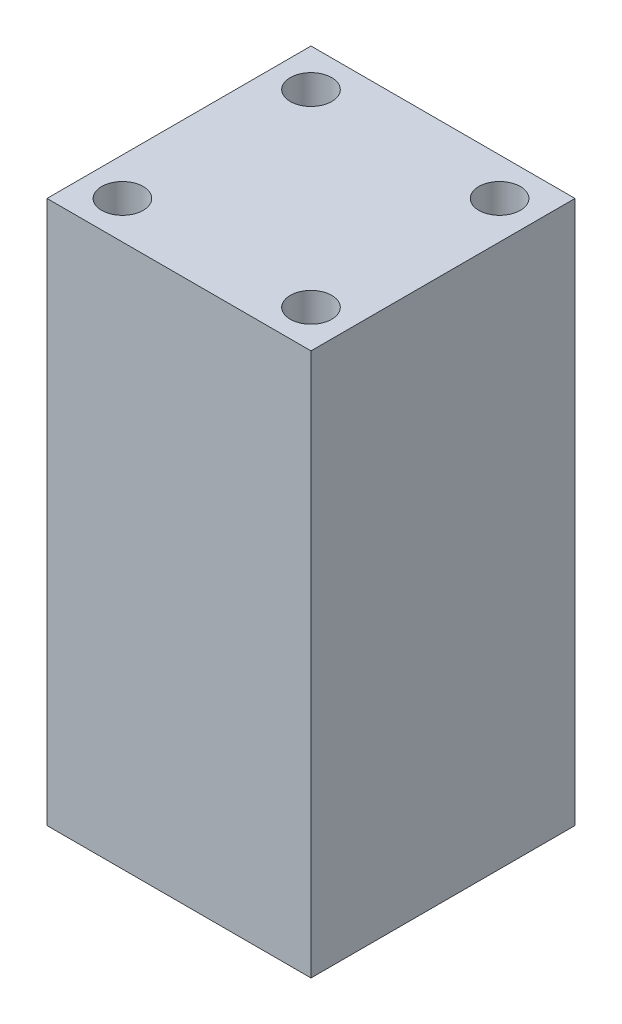
from build123d import *

# Parameters (mm, degrees)
SKETCH1_W           = 35
SKETCH1_H           = 72
BOSS_EXTRUDE1_DEPTH = 17.5


with BuildPart() as part:
    # Sketch1 → Boss-Extrude1 (new, symmetric)
    with BuildSketch(Plane.XY):
        Rectangle(SKETCH1_W, SKETCH1_H)
    extrude(amount=BOSS_EXTRUDE1_DEPTH, both=True)

    # Sketch3 → M5 Clearance Hole1 (revolve, cut)
    with BuildSketch(Plane(origin=(-12.5, 36, -12.5), x_dir=(0, 0, 1), z_dir=(1, 0, 0))):
        Polygon((0, 0), (0, 9.652366702), (2.75, 8), (2.75, 0), align=None)
    m5_clearance_hole1 = revolve(axis=Axis((-12.5, 42.35, -12.5), (0, -1, 0)), mode=Mode.SUBTRACT)

    # Mirror1: M5 Clearance Hole1 across plane
    add(m5_clearance_hole1.mirror(Plane(origin=(0, 0, 0), x_dir=(0, 0, 1), z_dir=(1, 0, 0))), mode=Mode.SUBTRACT)

    # Mirror2: M5 Clearance Hole1 across plane
    add(m5_clearance_hole1.mirror(Plane.XY), mode=Mode.SUBTRACT)

    # Mirror2 copy 1 sketch → Mirror2 copy 1 (revolve, cut)
    with BuildSketch(Plane(origin=(12.5, 36, 12.5), x_dir=(0, 0, -1), z_dir=(-1, 0, 0))):
        Polygon((0, 0), (0, 9.652366702), (2.75, 8), (2.75, 0), align=None)
    revolve(axis=Axis((12.5, 42.35, 12.5), (0, -1, 0)), mode=Mode.SUBTRACT)

    # Mirror3: M5 Clearance Hole1 across plane
    add(m5_clearance_hole1.mirror(Plane.ZX), mode=Mode.SUBTRACT)

    # Mirror3 copy 1 sketch → Mirror3 copy 1 (revolve, cut)
    with BuildSketch(Plane(origin=(12.5, -36, -12.5), x_dir=(0, 0, 1), z_dir=(-1, 0, 0))):
        Polygon((0, 0), (0, 9.652366702), (2.75, 8), (2.75, 0), align=None)
    revolve(axis=Axis((12.5, -42.35, -12.5), (0, 1, 0)), mode=Mode.SUBTRACT)

    # Mirror3 copy 2 sketch → Mirror3 copy 2 (revolve, cut)
    with BuildSketch(Plane(origin=(-12.5, -36, 12.5), x_dir=(0, 0, -1), z_dir=(1, 0, 0))):
        Polygon((0, 0), (0, 9.652366702), (2.75, 8), (2.75, 0), align=None)
    revolve(axis=Axis((-12.5, -42.35, 12.5), (0, 1, 0)), mode=Mode.SUBTRACT)

    # Mirror3 copy 3 sketch → Mirror3 copy 3 (revolve, cut)
    with BuildSketch(Plane(origin=(12.5, -36, 12.5), x_dir=(0, 0, -1), z_dir=(-1, 0, 0))):
        Polygon((0, 0), (0, -9.652366702), (2.75, -8), (2.75, 0), align=None)
    revolve(axis=Axis((12.5, -42.35, 12.5), (0, -1, 0)), mode=Mode.SUBTRACT)

    # Sketch6 → M4 Clearance Hole1 (revolve, cut)
    with BuildSketch(Plane(origin=(-17.5, 15, -12.5), x_dir=(0, 0, 1), z_dir=(0, 1, 0))):
        Polygon((0, 0), (0, 9.351936393), (2.25, 8), (2.25, 0), align=None)
    m4_clearance_hole1 = revolve(axis=Axis((-23.85, 15, -12.5), (1, 0, 0)), mode=Mode.SUBTRACT)

    # Mirror4: M4 Clearance Hole1 across plane
    add(m4_clearance_hole1.mirror(Plane.XY), mode=Mode.SUBTRACT)

    # Mirror5 copy 1 sketch → Mirror5 copy 1 (revolve, cut)
    with BuildSketch(Plane(origin=(-17.5, -15, 12.5), x_dir=(0, 0, -1), z_dir=(0, -1, 0))):
        Polygon((0, 0), (0, 9.351936393), (2.25, 8), (2.25, 0), align=None)
    revolve(axis=Axis((-23.85, -15, 12.5), (1, 0, 0)), mode=Mode.SUBTRACT)

    # Mirror5 copy 2 sketch → Mirror5 copy 2 (revolve, cut)
    with BuildSketch(Plane(origin=(-17.5, -15, -12.5), x_dir=(0, 0, 1), z_dir=(0, -1, 0))):
        Polygon((0, 0), (0, -9.351936393), (2.25, -8), (2.25, 0), align=None)
    revolve(axis=Axis((-23.85, -15, -12.5), (-1, 0, 0)), mode=Mode.SUBTRACT)


solid = part.part
